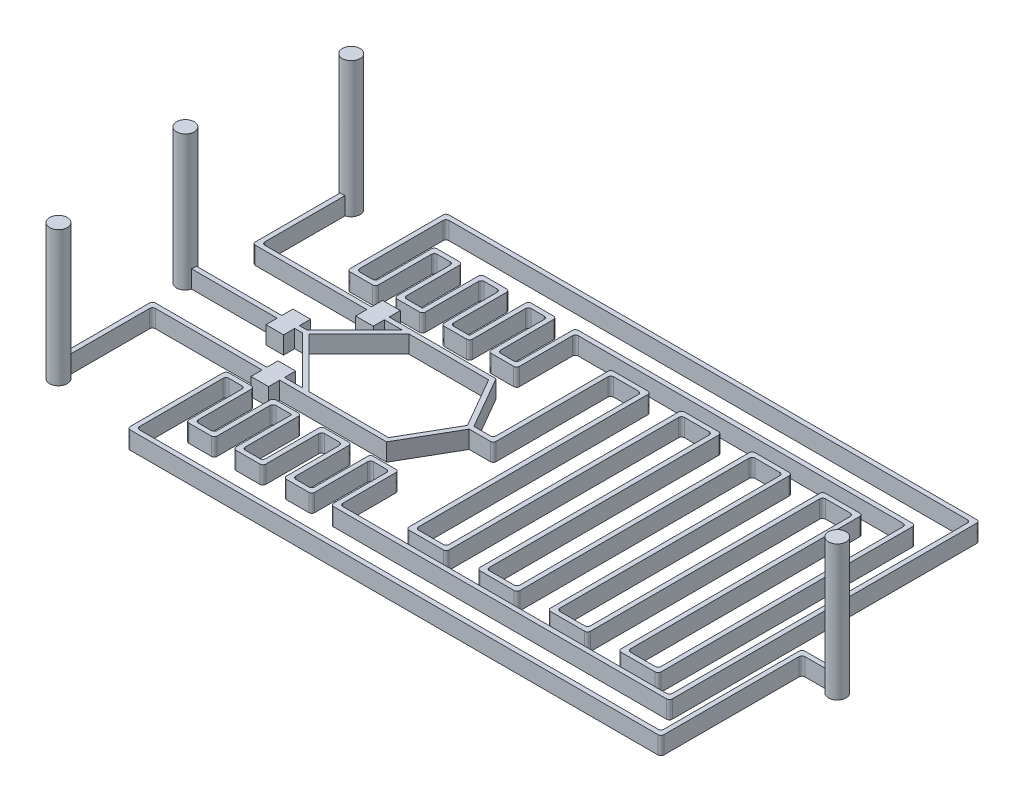
from build123d import *

# Parameters (mm, degrees)
BOSS_EXTRUDE1_DEPTH = 1.5
SKETCH4_R           = 0.75
BOSS_EXTRUDE2_DEPTH = 10


with BuildPart() as part:
    # Sketch3 → Boss-Extrude1 (new body)
    with BuildSketch(Plane(origin=(0, 0, 0), x_dir=(1, 0, 0), z_dir=(0, 1, 0))):
        with BuildLine():
            Line((19.944059303, -2.927457836), (19.944059303, -14.427457836))
            ThreePointArc((19.944059303, -14.427457836), (19.870835998, -14.604234532), (19.694059303, -14.677457836))
            Line((19.694059303, -14.677457836), (-25.205940697, -14.677457836))
            ThreePointArc((-25.205940697, -14.677457836), (-25.382717392, -14.604234532), (-25.455940697, -14.427457836))
            Line((-25.455940697, -14.427457836), (-25.455940697, -6.527457836))
            ThreePointArc((-25.455940697, -6.527457836), (-25.382717392, -6.350681141), (-25.205940697, -6.277457836))
            Line((-25.205940697, -6.277457836), (-23.305940697, -6.277457836))
            ThreePointArc((-23.305940697, -6.277457836), (-23.129164002, -6.350681141), (-23.055940697, -6.527457836))
            Line((-23.055940697, -6.527457836), (-23.055940697, -11.027457836))
            ThreePointArc((-23.055940697, -11.027457836), (-22.982717392, -11.204234532), (-22.805940697, -11.277457836))
            Line((-22.805940697, -11.277457836), (-21.705940697, -11.277457836))
            ThreePointArc((-21.705940697, -11.277457836), (-21.529164002, -11.204234532), (-21.455940697, -11.027457836))
            Line((-21.455940697, -11.027457836), (-21.455940697, -6.527457836))
            ThreePointArc((-21.455940697, -6.527457836), (-21.382717392, -6.350681141), (-21.205940697, -6.277457836))
            Line((-21.205940697, -6.277457836), (-19.305940697, -6.277457836))
            ThreePointArc((-19.305940697, -6.277457836), (-19.129164002, -6.350681141), (-19.055940697, -6.527457836))
            Line((-19.055940697, -6.527457836), (-19.055940697, -11.027457836))
            ThreePointArc((-19.055940697, -11.027457836), (-18.982717392, -11.204234532), (-18.805940697, -11.277457836))
            Line((-18.805940697, -11.277457836), (-17.570545474, -11.277457836))
            ThreePointArc((-17.570545474, -11.277457836), (-17.393768779, -11.204234532), (-17.320545474, -11.027457836))
            Line((-17.320545474, -11.027457836), (-17.320545474, -6.527457836))
            ThreePointArc((-17.320545474, -6.527457836), (-17.247322169, -6.350681141), (-17.070545474, -6.277457836))
            Line((-17.070545474, -6.277457836), (-15.0103138, -6.277457836))
            ThreePointArc((-15.0103138, -6.277457836), (-14.833537105, -6.350681141), (-14.7603138, -6.527457836))
            Line((-14.7603138, -6.527457836), (-14.7603138, -11.027457836))
            ThreePointArc((-14.7603138, -11.027457836), (-14.687090495, -11.204234532), (-14.5103138, -11.277457836))
            Line((-14.5103138, -11.277457836), (-13.4103138, -11.277457836))
            ThreePointArc((-13.4103138, -11.277457836), (-13.233537105, -11.204234532), (-13.1603138, -11.027457836))
            Line((-13.1603138, -11.027457836), (-13.1603138, -6.527457836))
            ThreePointArc((-13.1603138, -6.527457836), (-13.087090495, -6.350681141), (-12.9103138, -6.277457836))
            Line((-12.9103138, -6.277457836), (-11.0103138, -6.277457836))
            ThreePointArc((-11.0103138, -6.277457836), (-10.833537105, -6.350681141), (-10.7603138, -6.527457836))
            Line((-10.7603138, -6.527457836), (-10.7603138, -11.027457836))
            ThreePointArc((-10.7603138, -11.027457836), (-10.687090495, -11.204234532), (-10.5103138, -11.277457836))
            Line((-10.5103138, -11.277457836), (17.017132797, -11.277457836))
            ThreePointArc((17.017132797, -11.277457836), (17.193909492, -11.204234532), (17.267132797, -11.027457836))
            Line((17.267132797, -11.027457836), (17.267132797, 14.067071776))
            ThreePointArc((17.267132797, 14.067071776), (17.193909492, 14.243848471), (17.017132797, 14.317071776))
            Line((17.017132797, 14.317071776), (-27.082867203, 14.317071776))
            ThreePointArc((-27.082867203, 14.317071776), (-27.259643898, 14.243848471), (-27.332867203, 14.067071776))
            Line((-27.332867203, 14.067071776), (-27.332867203, 6.967071776))
            ThreePointArc((-27.332867203, 6.967071776), (-27.259643898, 6.790295081), (-27.082867203, 6.717071776))
            Line((-27.082867203, 6.717071776), (-25.982867203, 6.717071776))
            ThreePointArc((-25.982867203, 6.717071776), (-25.806090508, 6.790295081), (-25.732867203, 6.967071776))
            Line((-25.732867203, 6.967071776), (-25.732867203, 11.467071776))
            ThreePointArc((-25.732867203, 11.467071776), (-25.659643898, 11.643848471), (-25.482867203, 11.717071776))
            Line((-25.482867203, 11.717071776), (-23.582867203, 11.717071776))
            ThreePointArc((-23.582867203, 11.717071776), (-23.406090508, 11.643848471), (-23.332867203, 11.467071776))
            Line((-23.332867203, 11.467071776), (-23.332867203, 6.967071776))
            ThreePointArc((-23.332867203, 6.967071776), (-23.259643898, 6.790295081), (-23.082867203, 6.717071776))
            Line((-23.082867203, 6.717071776), (-21.732867203, 6.717071776))
            Line((-21.732867203, 6.717071776), (-21.732867203, 11.467071776))
            ThreePointArc((-21.732867203, 11.467071776), (-21.659643898, 11.643848471), (-21.482867203, 11.717071776))
            Line((-21.482867203, 11.717071776), (-19.582867203, 11.717071776))
            ThreePointArc((-19.582867203, 11.717071776), (-19.406090508, 11.643848471), (-19.332867203, 11.467071776))
            Line((-19.332867203, 11.467071776), (-19.332867203, 6.967071776))
            ThreePointArc((-19.332867203, 6.967071776), (-19.259643898, 6.790295081), (-19.082867203, 6.717071776))
            Line((-19.082867203, 6.717071776), (-17.732867203, 6.717071776))
            Line((-17.732867203, 6.717071776), (-17.732867203, 11.467071776))
            ThreePointArc((-17.732867203, 11.467071776), (-17.659643898, 11.643848471), (-17.482867203, 11.717071776))
            Line((-17.482867203, 11.717071776), (-15.582867203, 11.717071776))
            ThreePointArc((-15.582867203, 11.717071776), (-15.406090508, 11.643848471), (-15.332867203, 11.467071776))
            Line((-15.332867203, 11.467071776), (-15.332867203, 6.967071776))
            ThreePointArc((-15.332867203, 6.967071776), (-15.259643898, 6.790295081), (-15.082867203, 6.717071776))
            Line((-15.082867203, 6.717071776), (-13.980927316, 6.717071776))
            ThreePointArc((-13.980927316, 6.717071776), (-13.804150621, 6.790295081), (-13.730927316, 6.967071776))
            Line((-13.730927316, 6.967071776), (-13.730927316, 11.467071776))
            ThreePointArc((-13.730927316, 11.467071776), (-13.657704011, 11.643848471), (-13.480927316, 11.717071776))
            Line((-13.480927316, 11.717071776), (14.95, 11.717071776))
            ThreePointArc((14.95, 11.717071776), (15.126776695, 11.643848471), (15.2, 11.467071776))
            Line((15.2, 11.467071776), (15.2, 0))
            Line((15.2, 0), (15.2, -9.927457836))
            ThreePointArc((15.2, -9.927457836), (15.126776695, -10.104234532), (14.95, -10.177457836))
            Line((14.95, -10.177457836), (12.05, -10.177457836))
            ThreePointArc((12.05, -10.177457836), (11.873223305, -10.104234532), (11.8, -9.927457836))
            Line((11.8, -9.927457836), (11.8, 9.572542164))
            ThreePointArc((11.8, 9.572542164), (11.726776695, 9.749318859), (11.55, 9.822542164))
            Line((11.55, 9.822542164), (9.45, 9.822542164))
            ThreePointArc((9.45, 9.822542164), (9.273223305, 9.749318859), (9.2, 9.572542164))
            Line((9.2, 9.572542164), (9.2, -9.927457836))
            ThreePointArc((9.2, -9.927457836), (9.126776695, -10.104234532), (8.95, -10.177457836))
            Line((8.95, -10.177457836), (6.05, -10.177457836))
            ThreePointArc((6.05, -10.177457836), (5.873223305, -10.104234532), (5.8, -9.927457836))
            Line((5.8, -9.927457836), (5.8, 9.572542164))
            ThreePointArc((5.8, 9.572542164), (5.726776695, 9.749318859), (5.55, 9.822542164))
            Line((5.55, 9.822542164), (3.45, 9.822542164))
            ThreePointArc((3.45, 9.822542164), (3.273223305, 9.749318859), (3.2, 9.572542164))
            Line((3.2, 9.572542164), (3.2, -9.927457836))
            ThreePointArc((3.2, -9.927457836), (3.126776695, -10.104234532), (2.95, -10.177457836))
            Line((2.95, -10.177457836), (0.05, -10.177457836))
            ThreePointArc((0.05, -10.177457836), (-0.126776695, -10.104234532), (-0.2, -9.927457836))
            Line((-0.2, -9.927457836), (-0.2, 9.567071776))
            ThreePointArc((-0.2, 9.567071776), (-0.273223305, 9.743848471), (-0.45, 9.817071776))
            Line((-0.45, 9.817071776), (-2.55, 9.817071776))
            ThreePointArc((-2.55, 9.817071776), (-2.726776695, 9.743848471), (-2.8, 9.567071776))
            Line((-2.8, 9.567071776), (-2.8, -9.95))
            ThreePointArc((-2.8, -9.95), (-2.873223305, -10.126776695), (-3.05, -10.2))
            Line((-3.05, -10.2), (-5.95, -10.2))
            ThreePointArc((-5.95, -10.2), (-6.126776695, -10.126776695), (-6.2, -9.95))
            Line((-6.2, -9.95), (-6.2, 0))
            Line((-6.2, 0), (-6.2, 9.55))
            ThreePointArc((-6.2, 9.55), (-6.273223305, 9.726776695), (-6.45, 9.8))
            Line((-6.45, 9.8), (-8.55, 9.8))
            ThreePointArc((-8.55, 9.8), (-8.726776695, 9.726776695), (-8.8, 9.55))
            Line((-8.8, 9.55), (-8.8, 0.05))
            ThreePointArc((-8.8, 0.05), (-8.873223305, -0.126776695), (-9.05, -0.2))
            Line((-9.05, -0.2), (-10.844843746, -0.2))
            Line((-10.844843746, -0.2), (-13.415457262, -4.652433216))
            Line((-13.415457262, -4.652433216), (-22.507880584, -4.652433216))
            Line((-22.507880584, -4.652433216), (-22.507880584, -5.602433216))
            Line((-22.507880584, -5.602433216), (-24.007880584, -5.602433216))
            Line((-24.007880584, -5.602433216), (-24.007880584, -4.652433216))
            Line((-24.007880584, -4.652433216), (-33.080927316, -4.652433216))
            ThreePointArc((-33.080927316, -4.652433216), (-33.257704011, -4.725656521), (-33.330927316, -4.902433216))
            Line((-33.330927316, -4.902433216), (-33.330927316, -11.729591601))
            ThreePointArc((-33.330927316, -11.729591601), (-33.530927316, -13.202433216), (-33.730927316, -11.729591601))
            Line((-33.730927316, -11.729591601), (-33.730927316, -4.502433216))
            ThreePointArc((-33.730927316, -4.502433216), (-33.657704011, -4.325656521), (-33.480927316, -4.252433216))
            Line((-33.480927316, -4.252433216), (-24.007880584, -4.252433216))
            Line((-24.007880584, -4.252433216), (-24.007880584, -3.302433216))
            Line((-24.007880584, -3.302433216), (-22.507880584, -3.302433216))
            Line((-22.507880584, -3.302433216), (-22.507880584, -4.252433216))
            Line((-22.507880584, -4.252433216), (-20.990723297, -4.252433216))
            Line((-20.990723297, -4.252433216), (-25.043156513, -0.2))
            Line((-25.043156513, -0.2), (-25.685554997, -0.2))
            Line((-25.685554997, -0.2), (-25.685554997, -1.15))
            Line((-25.685554997, -1.15), (-27.185554997, -1.15))
            Line((-27.185554997, -1.15), (-27.185554997, -0.2))
            Line((-27.185554997, -0.2), (-34.462713382, -0.2))
            ThreePointArc((-34.462713382, -0.2), (-35.935554997, 0), (-34.462713382, 0.2))
            Line((-34.462713382, 0.2), (-27.185554997, 0.2))
            Line((-27.185554997, 0.2), (-27.185554997, 1.15))
            Line((-27.185554997, 1.15), (-25.685554997, 1.15))
            Line((-25.685554997, 1.15), (-25.685554997, 0.2))
            Line((-25.685554997, 0.2), (-25.043156513, 0.2))
            Line((-25.043156513, 0.2), (-20.990723297, 4.252433216))
            Line((-20.990723297, 4.252433216), (-22.507880584, 4.252433216))
            Line((-22.507880584, 4.252433216), (-22.507880584, 3.302433216))
            Line((-22.507880584, 3.302433216), (-24.007880584, 3.302433216))
            Line((-24.007880584, 3.302433216), (-24.007880584, 4.252433216))
            Line((-24.007880584, 4.252433216), (-33.480927316, 4.252433216))
            ThreePointArc((-33.480927316, 4.252433216), (-33.657704011, 4.325656521), (-33.730927316, 4.502433216))
            Line((-33.730927316, 4.502433216), (-33.730927316, 11.729591601))
            ThreePointArc((-33.730927316, 11.729591601), (-33.530927316, 13.202433216), (-33.330927316, 11.729591601))
            Line((-33.330927316, 11.729591601), (-33.330927316, 4.902433216))
            ThreePointArc((-33.330927316, 4.902433216), (-33.257704011, 4.725656521), (-33.080927316, 4.652433216))
            Line((-33.080927316, 4.652433216), (-24.007880584, 4.652433216))
            Line((-24.007880584, 4.652433216), (-24.007880584, 5.602433216))
            Line((-24.007880584, 5.602433216), (-22.507880584, 5.602433216))
            Line((-22.507880584, 5.602433216), (-22.507880584, 4.652433216))
            Line((-22.507880584, 4.652433216), (-13.415457262, 4.652433216))
            Line((-13.415457262, 4.652433216), (-10.844843746, 0.2))
            Line((-10.844843746, 0.2), (-9.45, 0.2))
            ThreePointArc((-9.45, 0.2), (-9.273223305, 0.273223305), (-9.2, 0.45))
            Line((-9.2, 0.45), (-9.2, 9.95))
            ThreePointArc((-9.2, 9.95), (-9.126776695, 10.126776695), (-8.95, 10.2))
            Line((-8.95, 10.2), (-6.05, 10.2))
            ThreePointArc((-6.05, 10.2), (-5.873223305, 10.126776695), (-5.8, 9.95))
            Line((-5.8, 9.95), (-5.8, 0))
            Line((-5.8, 0), (-5.8, -9.55))
            ThreePointArc((-5.8, -9.55), (-5.726776695, -9.726776695), (-5.55, -9.8))
            Line((-5.55, -9.8), (-3.45, -9.8))
            ThreePointArc((-3.45, -9.8), (-3.273223305, -9.726776695), (-3.2, -9.55))
            Line((-3.2, -9.55), (-3.2, 9.967071776))
            ThreePointArc((-3.2, 9.967071776), (-3.126776695, 10.143848471), (-2.95, 10.217071776))
            Line((-2.95, 10.217071776), (-0.05, 10.217071776))
            ThreePointArc((-0.05, 10.217071776), (0.126776695, 10.143848471), (0.2, 9.967071776))
            Line((0.2, 9.967071776), (0.2, -9.527457836))
            ThreePointArc((0.2, -9.527457836), (0.273223305, -9.704234532), (0.45, -9.777457836))
            Line((0.45, -9.777457836), (2.55, -9.777457836))
            ThreePointArc((2.55, -9.777457836), (2.726776695, -9.704234532), (2.8, -9.527457836))
            Line((2.8, -9.527457836), (2.8, 9.972542164))
            ThreePointArc((2.8, 9.972542164), (2.873223305, 10.149318859), (3.05, 10.222542164))
            Line((3.05, 10.222542164), (5.95, 10.222542164))
            ThreePointArc((5.95, 10.222542164), (6.126776695, 10.149318859), (6.2, 9.972542164))
            Line((6.2, 9.972542164), (6.2, -9.527457836))
            ThreePointArc((6.2, -9.527457836), (6.273223305, -9.704234532), (6.45, -9.777457836))
            Line((6.45, -9.777457836), (8.55, -9.777457836))
            ThreePointArc((8.55, -9.777457836), (8.726776695, -9.704234532), (8.8, -9.527457836))
            Line((8.8, -9.527457836), (8.8, 9.972542164))
            ThreePointArc((8.8, 9.972542164), (8.873223305, 10.149318859), (9.05, 10.222542164))
            Line((9.05, 10.222542164), (11.95, 10.222542164))
            ThreePointArc((11.95, 10.222542164), (12.126776695, 10.149318859), (12.2, 9.972542164))
            Line((12.2, 9.972542164), (12.2, -9.527457836))
            ThreePointArc((12.2, -9.527457836), (12.273223305, -9.704234532), (12.45, -9.777457836))
            Line((12.45, -9.777457836), (14.55, -9.777457836))
            ThreePointArc((14.55, -9.777457836), (14.726776695, -9.704234532), (14.8, -9.527457836))
            Line((14.8, -9.527457836), (14.8, 0))
            Line((14.8, 0), (14.8, 11.067071776))
            ThreePointArc((14.8, 11.067071776), (14.726776695, 11.243848471), (14.55, 11.317071776))
            Line((14.55, 11.317071776), (-13.080927316, 11.317071776))
            ThreePointArc((-13.080927316, 11.317071776), (-13.257704011, 11.243848471), (-13.330927316, 11.067071776))
            Line((-13.330927316, 11.067071776), (-13.330927316, 6.567071776))
            ThreePointArc((-13.330927316, 6.567071776), (-13.404150621, 6.390295081), (-13.580927316, 6.317071776))
            Line((-13.580927316, 6.317071776), (-15.482867203, 6.317071776))
            ThreePointArc((-15.482867203, 6.317071776), (-15.659643898, 6.390295081), (-15.732867203, 6.567071776))
            Line((-15.732867203, 6.567071776), (-15.732867203, 11.067071776))
            ThreePointArc((-15.732867203, 11.067071776), (-15.806090508, 11.243848471), (-15.982867203, 11.317071776))
            Line((-15.982867203, 11.317071776), (-17.082867203, 11.317071776))
            ThreePointArc((-17.082867203, 11.317071776), (-17.259643898, 11.243848471), (-17.332867203, 11.067071776))
            Line((-17.332867203, 11.067071776), (-17.332867203, 6.567071776))
            ThreePointArc((-17.332867203, 6.567071776), (-17.406090508, 6.390295081), (-17.582867203, 6.317071776))
            Line((-17.582867203, 6.317071776), (-19.482867203, 6.317071776))
            ThreePointArc((-19.482867203, 6.317071776), (-19.659643898, 6.390295081), (-19.732867203, 6.567071776))
            Line((-19.732867203, 6.567071776), (-19.732867203, 11.067071776))
            ThreePointArc((-19.732867203, 11.067071776), (-19.806090508, 11.243848471), (-19.982867203, 11.317071776))
            Line((-19.982867203, 11.317071776), (-21.082867203, 11.317071776))
            ThreePointArc((-21.082867203, 11.317071776), (-21.259643898, 11.243848471), (-21.332867203, 11.067071776))
            Line((-21.332867203, 11.067071776), (-21.332867203, 6.567071776))
            ThreePointArc((-21.332867203, 6.567071776), (-21.406090508, 6.390295081), (-21.582867203, 6.317071776))
            Line((-21.582867203, 6.317071776), (-23.482867203, 6.317071776))
            ThreePointArc((-23.482867203, 6.317071776), (-23.659643898, 6.390295081), (-23.732867203, 6.567071776))
            Line((-23.732867203, 6.567071776), (-23.732867203, 11.067071776))
            ThreePointArc((-23.732867203, 11.067071776), (-23.806090508, 11.243848471), (-23.982867203, 11.317071776))
            Line((-23.982867203, 11.317071776), (-25.082867203, 11.317071776))
            ThreePointArc((-25.082867203, 11.317071776), (-25.259643898, 11.243848471), (-25.332867203, 11.067071776))
            Line((-25.332867203, 11.067071776), (-25.332867203, 6.567071776))
            ThreePointArc((-25.332867203, 6.567071776), (-25.406090508, 6.390295081), (-25.582867203, 6.317071776))
            Line((-25.582867203, 6.317071776), (-27.482867203, 6.317071776))
            ThreePointArc((-27.482867203, 6.317071776), (-27.659643898, 6.390295081), (-27.732867203, 6.567071776))
            Line((-27.732867203, 6.567071776), (-27.732867203, 14.467071776))
            ThreePointArc((-27.732867203, 14.467071776), (-27.659643898, 14.643848471), (-27.482867203, 14.717071776))
            Line((-27.482867203, 14.717071776), (17.417132797, 14.717071776))
            ThreePointArc((17.417132797, 14.717071776), (17.593909492, 14.643848471), (17.667132797, 14.467071776))
            Line((17.667132797, 14.467071776), (17.667132797, -11.427457836))
            ThreePointArc((17.667132797, -11.427457836), (17.593909492, -11.604234532), (17.417132797, -11.677457836))
            Line((17.417132797, -11.677457836), (-10.9103138, -11.677457836))
            ThreePointArc((-10.9103138, -11.677457836), (-11.087090495, -11.604234532), (-11.1603138, -11.427457836))
            Line((-11.1603138, -11.427457836), (-11.1603138, -6.927457836))
            ThreePointArc((-11.1603138, -6.927457836), (-11.233537105, -6.750681141), (-11.4103138, -6.677457836))
            Line((-11.4103138, -6.677457836), (-12.5103138, -6.677457836))
            ThreePointArc((-12.5103138, -6.677457836), (-12.687090495, -6.750681141), (-12.7603138, -6.927457836))
            Line((-12.7603138, -6.927457836), (-12.7603138, -11.427457836))
            ThreePointArc((-12.7603138, -11.427457836), (-12.833537105, -11.604234532), (-13.0103138, -11.677457836))
            Line((-13.0103138, -11.677457836), (-14.9103138, -11.677457836))
            ThreePointArc((-14.9103138, -11.677457836), (-15.087090495, -11.604234532), (-15.1603138, -11.427457836))
            Line((-15.1603138, -11.427457836), (-15.1603138, -6.927457836))
            ThreePointArc((-15.1603138, -6.927457836), (-15.233537105, -6.750681141), (-15.4103138, -6.677457836))
            Line((-15.4103138, -6.677457836), (-16.670545474, -6.677457836))
            ThreePointArc((-16.670545474, -6.677457836), (-16.847322169, -6.750681141), (-16.920545474, -6.927457836))
            Line((-16.920545474, -6.927457836), (-16.920545474, -11.427457836))
            ThreePointArc((-16.920545474, -11.427457836), (-16.993768779, -11.604234532), (-17.170545474, -11.677457836))
            Line((-17.170545474, -11.677457836), (-19.205940697, -11.677457836))
            ThreePointArc((-19.205940697, -11.677457836), (-19.382717392, -11.604234532), (-19.455940697, -11.427457836))
            Line((-19.455940697, -11.427457836), (-19.455940697, -6.677457836))
            Line((-19.455940697, -6.677457836), (-20.805940697, -6.677457836))
            ThreePointArc((-20.805940697, -6.677457836), (-20.982717392, -6.750681141), (-21.055940697, -6.927457836))
            Line((-21.055940697, -6.927457836), (-21.055940697, -11.427457836))
            ThreePointArc((-21.055940697, -11.427457836), (-21.129164002, -11.604234532), (-21.305940697, -11.677457836))
            Line((-21.305940697, -11.677457836), (-23.205940697, -11.677457836))
            ThreePointArc((-23.205940697, -11.677457836), (-23.382717392, -11.604234532), (-23.455940697, -11.427457836))
            Line((-23.455940697, -11.427457836), (-23.455940697, -6.927457836))
            ThreePointArc((-23.455940697, -6.927457836), (-23.529164002, -6.750681141), (-23.705940697, -6.677457836))
            Line((-23.705940697, -6.677457836), (-24.805940697, -6.677457836))
            ThreePointArc((-24.805940697, -6.677457836), (-24.982717392, -6.750681141), (-25.055940697, -6.927457836))
            Line((-25.055940697, -6.927457836), (-25.055940697, -14.027457836))
            ThreePointArc((-25.055940697, -14.027457836), (-24.982717392, -14.204234532), (-24.805940697, -14.277457836))
            Line((-24.805940697, -14.277457836), (19.294059303, -14.277457836))
            ThreePointArc((19.294059303, -14.277457836), (19.470835998, -14.204234532), (19.544059303, -14.027457836))
            Line((19.544059303, -14.027457836), (19.544059303, -2.527457836))
            ThreePointArc((19.544059303, -2.527457836), (19.617282608, -2.350681141), (19.794059303, -2.277457836))
            Line((19.794059303, -2.277457836), (22.021217688, -2.277457836))
            ThreePointArc((22.021217688, -2.277457836), (23.494059303, -2.477457836), (22.021217688, -2.677457836))
            Line((22.021217688, -2.677457836), (20.194059303, -2.677457836))
            ThreePointArc((20.194059303, -2.677457836), (20.017282608, -2.750681141), (19.944059303, -2.927457836))
        make_face()
        Polygon((-24.677471088, 0), (-20.425037872, 4.252433216), (-13.64639737, 4.252433216), (-11.191253908, 0), (-13.64639737, -4.252433216), (-20.425037872, -4.252433216), align=None, mode=Mode.SUBTRACT)
    extrude(amount=BOSS_EXTRUDE1_DEPTH)

    # Sketch4 → Boss-Extrude2 (add)
    with BuildSketch(Plane(origin=(0, 1.5, 0), x_dir=(1, 0, 0), z_dir=(0, 1, 0))):
        with Locations(Location((22.744059303, -2.477457836, 0), (0, 0, 164.533990047))):
            Circle(SKETCH4_R)
        with Locations(Location((-33.530927316, -12.452433216, 0), (0, 0, 105.466009953))):
            Circle(SKETCH4_R)
        with Locations(Location((-35.185554997, 0, 0), (0, 0, 15.466009953))):
            Circle(SKETCH4_R)
        with Locations(Location((-33.530927316, 12.452433216, 0), (0, 0, 254.533990047))):
            Circle(SKETCH4_R)
    extrude(amount=BOSS_EXTRUDE2_DEPTH)


solid = part.part
